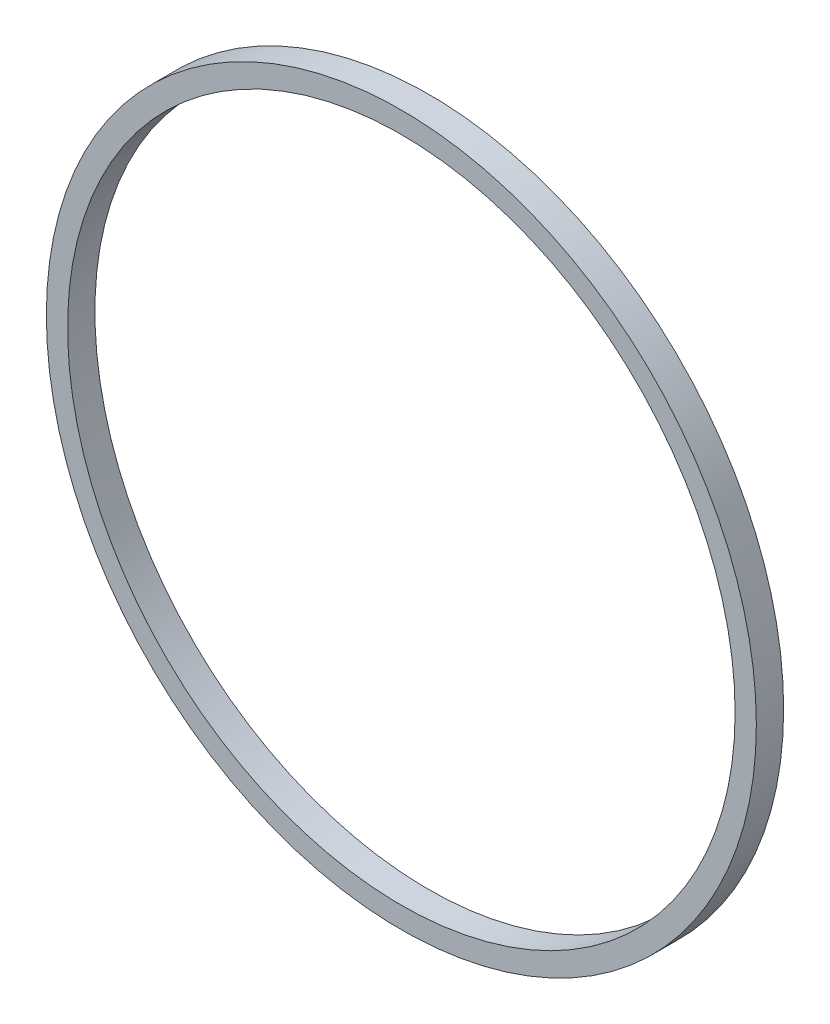
from build123d import *

# Parameters (mm, degrees)
SKETCH1_R           = 58.5
SKETCH1_R_2         = 55
BOSS_EXTRUDE1_DEPTH = 4.5


with BuildPart() as part:
    # Sketch1 → Boss-Extrude1 (new body)
    with BuildSketch(Plane.XY):
        with Locations((70.131179234, 84.268032687)):
            Circle(SKETCH1_R)
        with Locations((70.131179234, 84.268032687)):
            Circle(SKETCH1_R_2, mode=Mode.SUBTRACT)
    extrude(amount=BOSS_EXTRUDE1_DEPTH)


solid = part.part
